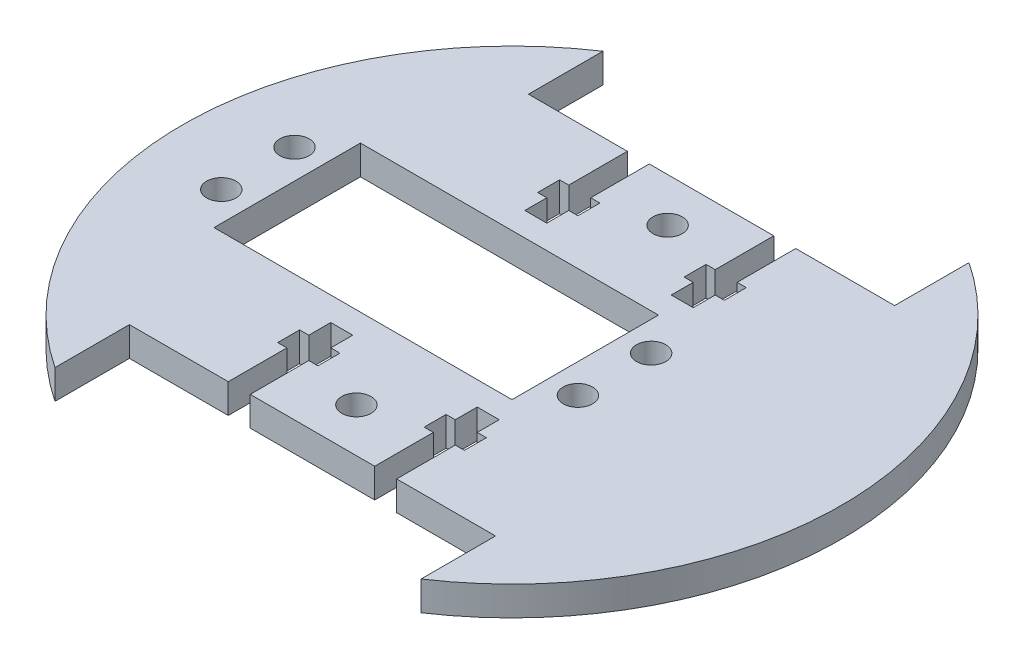
from build123d import *

# Parameters (mm, degrees)
ESTRUSIONE_ESTRUSIONE1_DEPTH = 2
CORTAR_EXTRUIR4_DEPTH        = 10
CROQUIS2_R                   = 2
CROQUIS2_W                   = 40.7
CROQUIS2_H                   = 20
CORTAR_EXTRUIR5_DEPTH        = 59.660037504


with BuildPart() as part:
    # Schizzo1 → Estrusione-Estrusione1 (new, symmetric)
    with BuildSketch(Plane(origin=(0, 0, 0), x_dir=(1, 0, 0), z_dir=(0, 1, 0))):
        with BuildLine():
            Line((-25, 37.416573868), (-25, 27.25))
            Line((-25, 27.25), (25, 27.25))
            Line((25, 27.25), (25, 37.416573868))
            ThreePointArc((25, 37.416573868), (45, 0), (25, -37.416573868))
            Line((25, -37.416573868), (25, -27.25))
            Line((25, -27.25), (-25, -27.25))
            Line((-25, -27.25), (-25, -37.416573868))
            ThreePointArc((-25, -37.416573868), (-45, 0), (-25, 37.416573868))
        make_face()
    extrude(amount=ESTRUSIONE_ESTRUSIONE1_DEPTH, both=True)

    # Croquis1 → Cortar-Extruir4 (cut)
    with BuildSketch(Plane.XZ.offset(2)):
        Polygon((-8.5, 27.25), (-11.5, 27.25), (-11.5, 19.25), (-12.75, 19.25), (-12.75, 16.25), (-11.5, 16.25), (-11.5, 13.25), (-8.5, 13.25), (-8.5, 16.25), (-7.25, 16.25), (-7.25, 19.25), (-8.5, 19.25), align=None)
        Polygon((11.5, 27.25), (8.5, 27.25), (8.5, 19.25), (7.25, 19.25), (7.25, 16.25), (8.5, 16.25), (8.5, 13.25), (11.5, 13.25), (11.5, 16.25), (12.75, 16.25), (12.75, 19.25), (11.5, 19.25), align=None)
        Polygon((8.5, -13.25), (8.5, -16.25), (7.25, -16.25), (7.25, -19.25), (8.5, -19.25), (8.5, -27.25), (11.5, -27.25), (11.5, -19.25), (12.75, -19.25), (12.75, -16.25), (11.5, -16.25), (11.5, -13.25), align=None)
        Polygon((-11.5, -13.25), (-11.5, -16.25), (-12.75, -16.25), (-12.75, -19.25), (-11.5, -19.25), (-11.5, -27.25), (-8.5, -27.25), (-8.5, -19.25), (-7.25, -19.25), (-7.25, -16.25), (-8.5, -16.25), (-8.5, -13.25), align=None)
    extrude(amount=-CORTAR_EXTRUIR4_DEPTH, mode=Mode.SUBTRACT)

    # Croquis2 → Cortar-Extruir5 (cut, through all)
    with BuildSketch(Plane(origin=(0, 2, 0), x_dir=(1, 0, 0), z_dir=(0, 1, 0))):
        with Locations(Location((-34.7, 5, 0), (0, 0, 270))):
            Circle(CROQUIS2_R)
        with Locations(Location((-34.7, -5, 0), (0, 0, 270))):
            Circle(CROQUIS2_R)
        with Locations(Location((14, 5, 0), (0, 0, 270))):
            Circle(CROQUIS2_R)
        with Locations(Location((14, -5, 0), (0, 0, 270))):
            Circle(CROQUIS2_R)
        with Locations(Location((0, 21.25, 0), (0, 0, 270))):
            Circle(CROQUIS2_R)
        with Locations(Location((0, -21.25, 0), (0, 0, 270))):
            Circle(CROQUIS2_R)
        with Locations((-10.35, 0)):
            Rectangle(CROQUIS2_W, CROQUIS2_H)
    extrude(amount=-CORTAR_EXTRUIR5_DEPTH, mode=Mode.SUBTRACT)


solid = part.part
